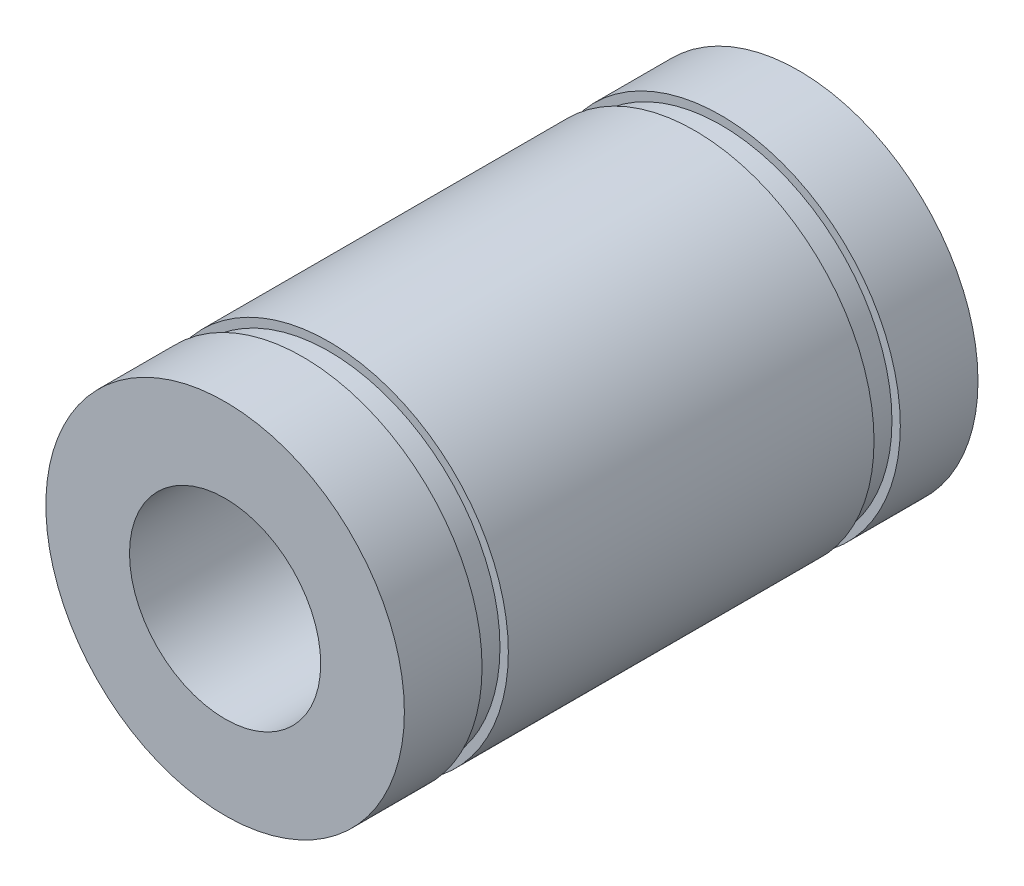
from build123d import *

# Parameters (mm, degrees)
SKETCH_1_R      = 7.5
SKETCH_1_R_2    = 4
EXTRUDE_1_DEPTH = 12
SKETCH_2_W      = 1.1
SKETCH_2_H      = 0.35


with BuildPart() as part:
    # 草图1 → 凸台-拉伸1 (new, symmetric)
    with BuildSketch(Plane.XY):
        Circle(SKETCH_1_R)
        Circle(SKETCH_1_R_2, mode=Mode.SUBTRACT)
    extrude(amount=EXTRUDE_1_DEPTH, both=True)

    # 草图2 → 切除-旋转1 (revolve, cut)
    with BuildSketch(Plane(origin=(0, 0, 0), x_dir=(0, 0, -1), z_dir=(1, 0, 0)), mode=Mode.PRIVATE) as cut_revolve_1_sk:
        with Locations((-8.2, 7.325)):
            Rectangle(SKETCH_2_W, SKETCH_2_H)
    cut_revolve_1 = revolve(cut_revolve_1_sk.sketch.rotate(Axis((0, 0, 1000), (0, 0, -1)), 90), axis=Axis((0, 0, 1000), (0, 0, -1)), mode=Mode.SUBTRACT)

    # 镜向1: 切除-旋转1 across plane
    add(cut_revolve_1.mirror(Plane.XY), mode=Mode.SUBTRACT)


solid = part.part
